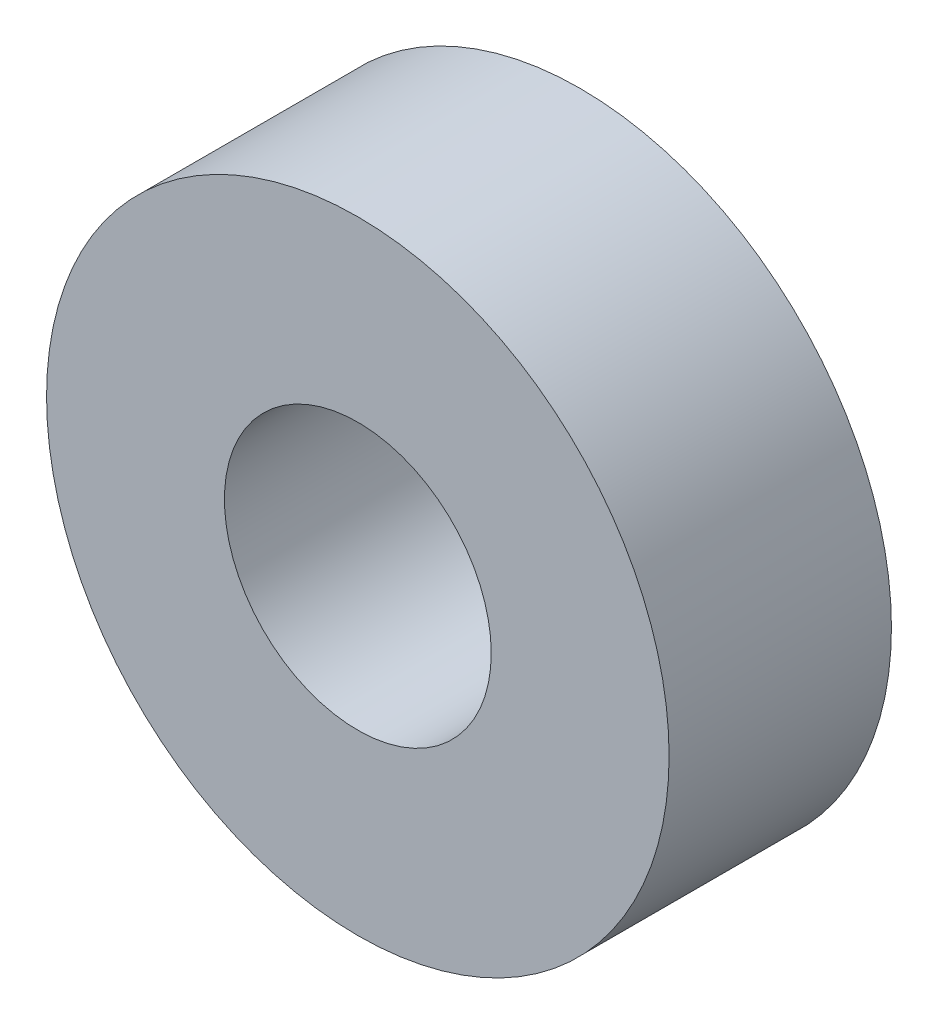
from build123d import *

# Parameters (mm, degrees)
SKETCH_1_R      = 7
SKETCH_1_R_2    = 3
EXTRUDE_1_DEPTH = 2.5


with BuildPart() as part:
    # 草图1 → 凸台-拉伸1 (new, symmetric)
    with BuildSketch(Plane.XY):
        Circle(SKETCH_1_R)
        Circle(SKETCH_1_R_2, mode=Mode.SUBTRACT)
    extrude(amount=EXTRUDE_1_DEPTH, both=True)


solid = part.part
